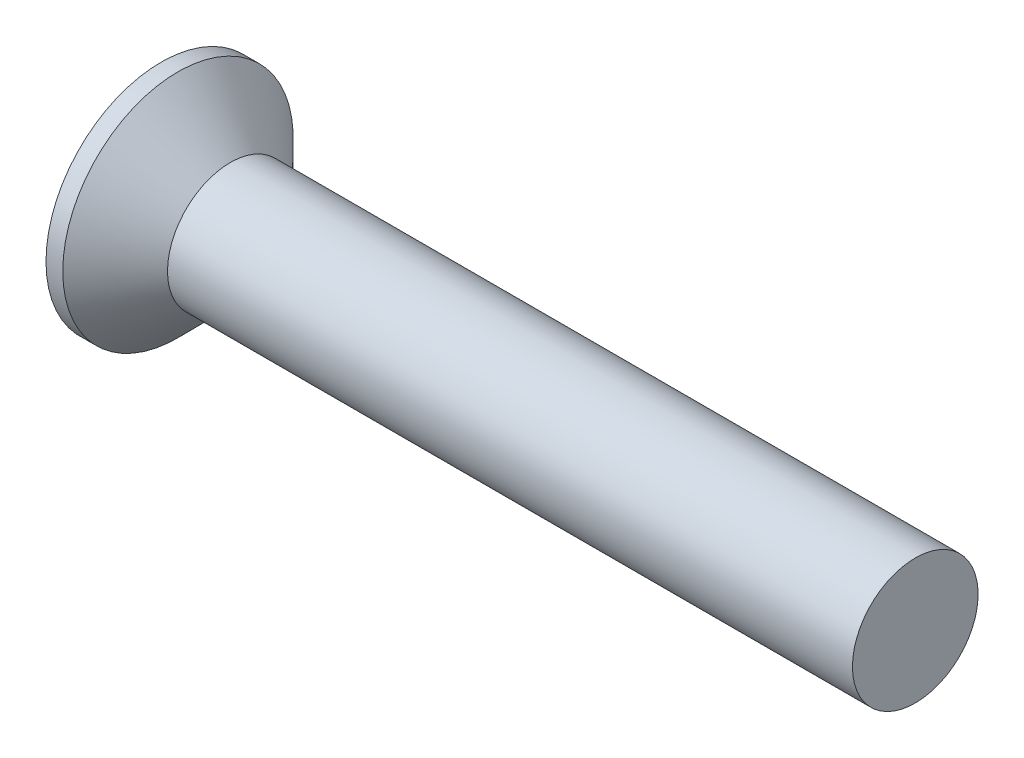
from build123d import *


with BuildPart() as part:
    # Esquisse1 → Révolution1 (revolve)
    with BuildSketch(Plane.XY, mode=Mode.PRIVATE) as r_volution1_sk:
        Polygon((0, 0), (18, 0), (18, 1.5), (1.65, 1.5), (0.4, 2.75), (0, 2.75), align=None)
    revolve(r_volution1_sk.sketch.rotate(Axis((0, 0, 0), (1, 0, 0)), 90), axis=Axis((0, 0, 0), (1, 0, 0)))


solid = part.part
